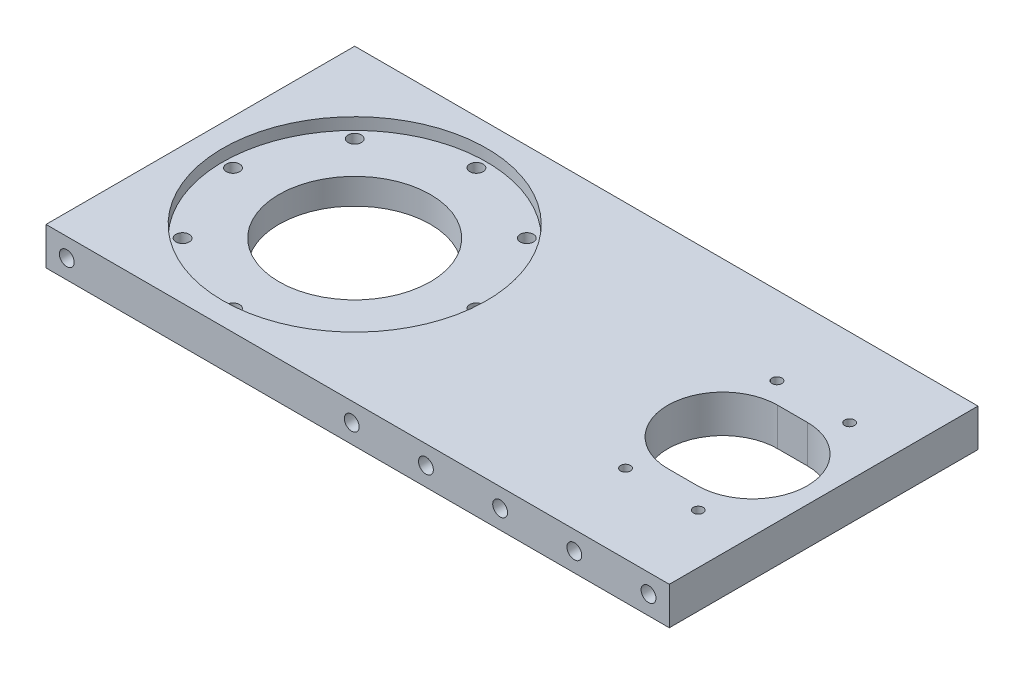
from build123d import *

# Parameters (mm, degrees)
EXTRUDE_1_DEPTH      = 30
SKETCH_2_R           = 44.45
CUT_EXTRUDE_1_DEPTH  = 4
SKETCH_3_R           = 25.5
SKETCH_3_R_2         = 2.25
CUT_EXTRUDE_2_DEPTH  = 188.619295383
CUT_EXTRUDE_3_DEPTH  = 189.215302247
SKETCH_5_R           = 1.65
CUT_EXTRUDE_4_DEPTH  = 189.215302247
EXTRUDE_START        = -30
EXTRUDE_2_DEPTH      = 30
CUT_EXTRUDE_5_DEPTH  = 198.040604952
CUT_EXTRUDE_7_DEPTH  = 233.432785983
CUT_EXTRUDE_8_DEPTH  = 233.432785983
CUT_EXTRUDE_9_DEPTH  = 233.432785983
FILLET_1_R           = 5
CUT_EXTRUDE_10_DEPTH = 233.432785983
EXTRUDE_START_2      = -5
EXTRUDE_3_DEPTH      = 5
EXTRUDE_4_DEPTH      = 5
SKETCH_14_R          = 4.25
CUT_EXTRUDE_11_DEPTH = 189.364728478
SKETCH_16_W          = 43
SKETCH_16_H          = 30
CUT_EXTRUDE_12_DEPTH = 233.432785983
EXTRUDE_7_REACH      = 188.592
SKETCH_18_W          = 210
SKETCH_18_H          = 5
EXTRUDE_8_DEPTH      = 210
EXTRUDE_9_DEPTH      = 5
EXTRUDE_10_DEPTH     = 5
SKETCH_22_R          = 4.25
CUT_EXTRUDE_13_DEPTH = 187.984035343
FILLET_2_R           = 5
SKETCH_23_W          = 54.138987121
SKETCH_23_H          = 93.693059957
CUT_EXTRUDE_16_DEPTH = 234.418610938
SKETCH_24_R          = 2.5
CUT_EXTRUDE_17_DEPTH = 20
CUT_EXTRUDE_START    = -20
SKETCH_25_R          = 2.5
CUT_EXTRUDE_18_DEPTH = 20
SKETCH_26_R          = 4
CUT_EXTRUDE_19_DEPTH = 3


with BuildPart() as part:
    # 草图1 → 凸台-拉伸1 (new body)
    with BuildSketch(Plane(origin=(0, 0, 0), x_dir=(1, 0, 0), z_dir=(0, 1, 0))):
        with BuildLine():
            Line((170, 31.93), (170, -31.93))
            ThreePointArc((170, -31.93), (167.781993847, -38.210172909), (162.111885646, -41.704453387))
            Line((162.111885646, -41.704453387), (15.839142344, -73.308400404))
            ThreePointArc((15.839142344, -73.308400404), (-75, 0), (15.839142344, 73.308400404))
            Line((15.839142344, 73.308400404), (162.111885646, 41.704453387))
            ThreePointArc((162.111885646, 41.704453387), (167.781993847, 38.210172909), (170, 31.93))
        make_face()
    extrude(amount=EXTRUDE_1_DEPTH)

    # 草图2 → 切除-拉伸1 (cut)
    with BuildSketch(Plane(origin=(0, 30, 0), x_dir=(1, 0, 0), z_dir=(0, 1, 0))):
        with Locations(Location((0, 0, 0), (0, 0, 270))):
            Circle(SKETCH_2_R)
    extrude(amount=-CUT_EXTRUDE_1_DEPTH, mode=Mode.SUBTRACT)

    # 草图3 → 切除-拉伸2 (cut, through all)
    with BuildSketch(Plane(origin=(0, 26, 0), x_dir=(1, 0, 0), z_dir=(0, 1, 0))):
        with Locations(Location((0, 0, 0), (0, 0, 270))):
            Circle(SKETCH_3_R)
        with Locations(Location((0, 41, 0), (0, 0, 270))):
            Circle(SKETCH_3_R_2)
        with Locations(Location((28.991378029, 28.991378029, 0), (0, 0, 270))):
            Circle(SKETCH_3_R_2)
        with Locations(Location((41, 0, 0), (0, 0, 270))):
            Circle(SKETCH_3_R_2)
        with Locations(Location((28.991378029, -28.991378029, 0), (0, 0, 270))):
            Circle(SKETCH_3_R_2)
        with Locations(Location((0, -41, 0), (0, 0, 270))):
            Circle(SKETCH_3_R_2)
        with Locations(Location((-28.991378029, -28.991378029, 0), (0, 0, 270))):
            Circle(SKETCH_3_R_2)
        with Locations(Location((-41, 0, 0), (0, 0, 270))):
            Circle(SKETCH_3_R_2)
        with Locations(Location((-28.991378029, 28.991378029, 0), (0, 0, 270))):
            Circle(SKETCH_3_R_2)
    extrude(amount=-CUT_EXTRUDE_2_DEPTH, mode=Mode.SUBTRACT)

    # 草图4 → 切除-拉伸3 (cut, through all)
    with BuildSketch(Plane(origin=(0, 30, 0), x_dir=(1, 0, 0), z_dir=(0, 1, 0))):
        with BuildLine():
            Line((124, 18.5), (134, 18.5))
            ThreePointArc((134, 18.5), (152.5, 0), (134, -18.5))
            Line((134, -18.5), (124, -18.5))
            ThreePointArc((124, -18.5), (105.5, 0), (124, 18.5))
        make_face()
    extrude(amount=-CUT_EXTRUDE_3_DEPTH, mode=Mode.SUBTRACT)

    # 草图5 → 切除-拉伸4 (cut, through all)
    with BuildSketch(Plane(origin=(0, 30, 0), x_dir=(1, 0, 0), z_dir=(0, 1, 0))):
        with Locations(Location((116.75, 25.5, 0), (0, 0, 270))):
            Circle(SKETCH_5_R)
        with Locations(Location((141.25, 25.5, 0), (0, 0, 270))):
            Circle(SKETCH_5_R)
        with Locations(Location((141.25, -25.5, 0), (0, 0, 270))):
            Circle(SKETCH_5_R)
        with Locations(Location((116.75, -25.5, 0), (0, 0, 270))):
            Circle(SKETCH_5_R)
    extrude(amount=-CUT_EXTRUDE_4_DEPTH, mode=Mode.SUBTRACT)

    # 草图6 → 凸台-拉伸2 (add)
    with BuildSketch(Plane(origin=(0, 30, 0), x_dir=(1, 0, 0), z_dir=(0, 1, 0)).offset(EXTRUDE_START)):
        with BuildLine():
            Line((158, 95), (-52, 95))
            Line((-52, 95), (-52, 54.046276467))
            ThreePointArc((-52, 54.046276467), (-20.48558667, 72.148047366), (15.839142344, 73.308400404))
            Line((15.839142344, 73.308400404), (158, 42.592874655))
            Line((158, 42.592874655), (158, 95))
        make_face()
        with BuildLine():
            ThreePointArc((15.839142344, -73.308400404), (-20.48558667, -72.148047366), (-52, -54.046276467))
            Line((-52, -54.046276467), (-52, -95))
            Line((-52, -95), (158, -95))
            Line((158, -95), (158, -42.592874655))
            Line((158, -42.592874655), (15.839142344, -73.308400404))
        make_face()
    extrude(amount=EXTRUDE_2_DEPTH)

    # 草图7 → 切除-拉伸5 (cut, through all)
    with BuildSketch(Plane(origin=(0, 30, 0), x_dir=(1, 0, 0), z_dir=(0, 1, 0))):
        with BuildLine():
            Line((-52, 54.046276467), (-52, -54.046276467))
            ThreePointArc((-52, -54.046276467), (-75, 0), (-52, 54.046276467))
        make_face()
        with BuildLine():
            Line((158, 42.592874655), (158, -42.592874655))
            Line((158, -42.592874655), (162.111885646, -41.704453387))
            ThreePointArc((162.111885646, -41.704453387), (167.781993847, -38.210172909), (170, -31.93))
            Line((170, -31.93), (170, 31.93))
            ThreePointArc((170, 31.93), (167.781993847, 38.210172909), (162.111885646, 41.704453387))
            Line((162.111885646, 41.704453387), (158, 42.592874655))
        make_face()
    extrude(amount=-CUT_EXTRUDE_5_DEPTH, mode=Mode.SUBTRACT)

    # 草图9 → 切除-拉伸7 (cut, through all)
    with BuildSketch(Plane.ZY.offset(52)):
        Polygon((-95, 20), (-60, 10.621778265), (-60, 30), (-95, 30), align=None)
    extrude(amount=-CUT_EXTRUDE_7_DEPTH, mode=Mode.SUBTRACT)

    # 草图10 → 切除-拉伸8 (cut, through all)
    with BuildSketch(Plane.ZY.offset(52)):
        Polygon((-95, 12.753066737), (-52, 1.231251463), (-52, 0), (-95, 0), align=None)
    extrude(amount=-CUT_EXTRUDE_8_DEPTH, mode=Mode.SUBTRACT)

    # 草图8 → 切除-拉伸9 (cut, through all)
    with BuildSketch(Plane.ZY.offset(52)):
        Polygon((0, 0), (52, 0), (52, 17.3), (-52, 17.3), (-52, 0), align=None)
    extrude(amount=-CUT_EXTRUDE_9_DEPTH, mode=Mode.SUBTRACT)

    # 圆角1
    fillet_1_edges = [part.edges().sort_by_distance(p)[0] for p in [
        (53, 10.621778265, -60),
    ]]
    fillet(fillet_1_edges, radius=FILLET_1_R)

    # 草图11 → 切除-拉伸10 (cut, through all)
    with BuildSketch(Plane.ZY.offset(52)):
        Polygon((-95, 12.753066737), (-93.188266684, 19.514547521), (-95, 20), align=None)
    extrude(amount=-CUT_EXTRUDE_10_DEPTH, mode=Mode.SUBTRACT)

    # 草图12 → 凸台-拉伸3 (add)
    with BuildSketch(Plane.ZY.offset(52).offset(EXTRUDE_START_2)):
        with BuildLine():
            Line((-93.188266684, 19.514547521), (-60, 30))
            Line((-60, 30), (-60, 17.137905129))
            ThreePointArc((-60, 17.137905129), (-61.956192855, 13.171138428), (-66.294095226, 12.308275998))
            Line((-66.294095226, 12.308275998), (-93.188266684, 19.514547521))
        make_face()
    extrude(amount=EXTRUDE_3_DEPTH)

    # 草图13 → 凸台-拉伸4 (add)
    with BuildSketch(Plane(origin=(158, 0, 0), x_dir=(0, 0, -1), z_dir=(1, 0, 0))):
        with BuildLine():
            Line((66.294095226, 12.308275998), (93.188266684, 19.514547521))
            Line((93.188266684, 19.514547521), (60, 30))
            Line((60, 30), (60, 17.137905129))
            ThreePointArc((60, 17.137905129), (61.956192855, 13.171138428), (66.294095226, 12.308275998))
        make_face()
    extrude(amount=-EXTRUDE_4_DEPTH)

    # 草图14 → 切除-拉伸11 (cut, through all)
    with BuildSketch(Plane(origin=(0, -5.089745962, -1.36379332), x_dir=(1, 0, 0), z_dir=(0, 0.9659258262890681, 0.2588190451025214))):
        with Locations(Location((-27, 82.063690052, 0), (0, 0, 270))):
            Circle(SKETCH_14_R)
        with Locations(Location((23, 82.063690052, 0), (0, 0, 270))):
            Circle(SKETCH_14_R)
        with Locations(Location((83, 82.063690052, 0), (0, 0, 270))):
            Circle(SKETCH_14_R)
        with Locations(Location((133, 82.063690052, 0), (0, 0, 270))):
            Circle(SKETCH_14_R)
    extrude(amount=-CUT_EXTRUDE_11_DEPTH, mode=Mode.SUBTRACT)

    # 草图16 → 切除-拉伸12 (cut, through all)
    with BuildSketch(Plane.ZY.offset(52)):
        with Locations((73.5, 15)):
            Rectangle(SKETCH_16_W, SKETCH_16_H)
    extrude(amount=-CUT_EXTRUDE_12_DEPTH, mode=Mode.SUBTRACT)

    # 凸台-拉伸7: up to this plane
    extrude_7_end = Plane(origin=(0, -11.851226746, -3.175526636), z_dir=(0, -0.9659258262890681, -0.25881904510252146))
    # 草图18 → 凸台-拉伸7 (add, up to the surface)
    with BuildSketch(Plane(origin=(0, 30, 0), x_dir=(1, 0, 0), z_dir=(0, 1, 0)), mode=Mode.PRIVATE) as extrude_7_sk1:
        with Locations((53, -54.5)):
            Rectangle(SKETCH_18_W, SKETCH_18_H)
    extrude_7_tool1 = split(extrude(extrude_7_sk1.sketch, amount=-EXTRUDE_7_REACH, mode=Mode.PRIVATE), bisect_by=extrude_7_end, keep=Keep.BOTH, mode=Mode.PRIVATE)
    add(extrude_7_tool1.solids().sort_by_distance((53, 30, 54.5))[0])

    # 草图19 → 凸台-拉伸8 (add)
    with BuildSketch(Plane.ZY.offset(52)):
        Polygon((57, -27.975210512), (90.188266684, -36.867979769), (92, -30.106498985), (57, -20.72827725), align=None)
    extrude(amount=-EXTRUDE_8_DEPTH)

    # 草图20 → 凸台-拉伸9 (add)
    with BuildSketch(Plane.ZY.offset(52)):
        Polygon((92, -30.106498985), (57, -20.72827725), (57, 30), align=None)
    extrude(amount=-EXTRUDE_9_DEPTH)

    # 草图21 → 凸台-拉伸10 (add)
    with BuildSketch(Plane(origin=(158, 0, 0), x_dir=(0, 0, -1), z_dir=(1, 0, 0))):
        Polygon((-57, 30), (-92, -30.106498985), (-57, -20.72827725), align=None)
    extrude(amount=-EXTRUDE_10_DEPTH)

    # 草图22 → 切除-拉伸13 (cut, through all)
    with BuildSketch(Plane(origin=(0, -5.089745962, -1.36379332), x_dir=(1, 0, 0), z_dir=(0, 0.9659258262890686, 0.25881904510251946))):
        with Locations(Location((-27, -77.936309948, 0), (0, 0, 270))):
            Circle(SKETCH_22_R)
        with Locations(Location((23, -69.936309948, 0), (0, 0, 270))):
            Circle(SKETCH_22_R)
        with Locations(Location((83, -69.936309948, 0), (0, 0, 270))):
            Circle(SKETCH_22_R)
        with Locations(Location((133, -77.936309948, 0), (0, 0, 270))):
            Circle(SKETCH_22_R)
    extrude(amount=-CUT_EXTRUDE_13_DEPTH, mode=Mode.SUBTRACT)

    # 圆角2
    fillet_2_edges = [part.edges().sort_by_distance(p)[0] for p in [
        (53, -20.72827725, 57),
    ]]
    fillet(fillet_2_edges, radius=FILLET_2_R)

    # 草图23 → 切除-拉伸16 (cut, through all)
    with BuildSketch(Plane.ZY.offset(52)):
        Polygon((-52, 17.3), (-52, 43.805383113), (-100.3000192, 43.805383113), (-100.3000192, -10.996217994), (-52, -10.996217994), align=None)
        with Locations((79.069493561, -1.86261781)):
            Rectangle(SKETCH_23_W, SKETCH_23_H)
    extrude(amount=-CUT_EXTRUDE_16_DEPTH, mode=Mode.SUBTRACT)

    # 草图24 → 切除-拉伸17 (cut)
    with BuildSketch(Plane(origin=(0, 0, -52), x_dir=(-1, 0, 0), z_dir=(0, 0, -1))):
        with Locations((-126, 23.65)):
            Circle(SKETCH_24_R)
        with Locations((-101, 23.65)):
            Circle(SKETCH_24_R)
        with Locations((-151, 23.65)):
            Circle(SKETCH_24_R)
        with Locations((45, 23.65)):
            Circle(SKETCH_24_R)
        with Locations((-76, 23.65)):
            Circle(SKETCH_24_R)
        with Locations((-51, 23.65)):
            Circle(SKETCH_24_R)
    extrude(amount=-CUT_EXTRUDE_17_DEPTH, mode=Mode.SUBTRACT)

    # 草图25 → 切除-拉伸18 (cut)
    with BuildSketch(Plane.XY.offset(52).offset(CUT_EXTRUDE_START)):
        with Locations(Location((151, 23.65, 0), (0, 0, 180))):
            Circle(SKETCH_25_R)
        with Locations(Location((126, 23.65, 0), (0, 0, 180))):
            Circle(SKETCH_25_R)
        with Locations(Location((101, 23.65, 0), (0, 0, 180))):
            Circle(SKETCH_25_R)
        with Locations(Location((76, 23.65, 0), (0, 0, 180))):
            Circle(SKETCH_25_R)
        with Locations(Location((51, 23.65, 0), (0, 0, 180))):
            Circle(SKETCH_25_R)
        with Locations(Location((-45, 23.65, 0), (0, 0, 180))):
            Circle(SKETCH_25_R)
    extrude(amount=CUT_EXTRUDE_18_DEPTH, mode=Mode.SUBTRACT)

    # 草图26 → 切除-拉伸19 (cut)
    with BuildSketch(Plane.XZ.offset(-17.3)):
        with Locations(Location((0, 41, 0), (0, 0, 270))):
            Circle(SKETCH_26_R)
        with Locations(Location((28.991378029, 28.991378029, 0), (0, 0, 270))):
            Circle(SKETCH_26_R)
        with Locations(Location((41, 0, 0), (0, 0, 270))):
            Circle(SKETCH_26_R)
        with Locations(Location((28.991378029, -28.991378029, 0), (0, 0, 270))):
            Circle(SKETCH_26_R)
        with Locations(Location((0, -41, 0), (0, 0, 270))):
            Circle(SKETCH_26_R)
        with Locations(Location((-28.991378029, -28.991378029, 0), (0, 0, 270))):
            Circle(SKETCH_26_R)
        with Locations(Location((-41, 0, 0), (0, 0, 270))):
            Circle(SKETCH_26_R)
        with Locations(Location((-28.991378029, 28.991378029, 0), (0, 0, 270))):
            Circle(SKETCH_26_R)
    extrude(amount=-CUT_EXTRUDE_19_DEPTH, mode=Mode.SUBTRACT)


solid = part.part
